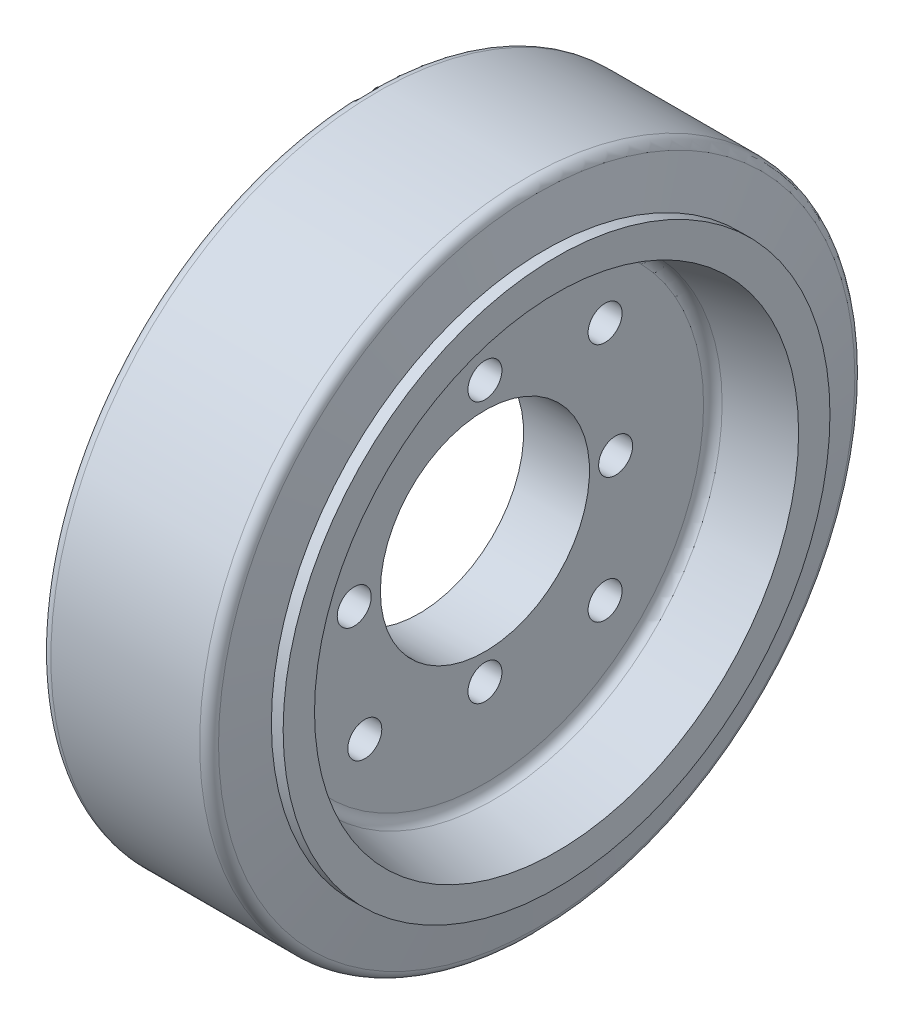
from build123d import *

# Parameters (mm, degrees)
FILLET1_R                  = 2
CUT_EXTRUDE1_DEPTH         = 93.869533426
CUT_EXTRUDE1_DEPTH_BACK    = 93.869533426
SKETCH2_R                  = 20
SKETCH3_R                  = 3.25
CUT_EXTRUDE2_DEPTH         = 93.218166533
F_6_5_6_5_DIAMETER_HOLE1_D = 6.5


with BuildPart() as part:
    # Sketch1 → Revolve1 (revolve)
    with BuildSketch(Plane.XY, mode=Mode.PRIVATE) as revolve1_sk:
        Polygon((-15.9, -62.5), (15.9, -62.5), (17.75, -52.3), (20, -52.3), (20, -46.3), (6.3, -43.45), (6.3, -17), (22.2, -15.75), (22.2, -10.05), (-22.2, -10.05), (-22.2, -15.75), (-6.3, -17), (-6.3, -43.45), (-20, -46.3), (-20, -52.3), (-17.75, -52.3), align=None)
    revolve(revolve1_sk.sketch.rotate(Axis((0, 0, 0), (1, 0, 0)), 270), axis=Axis((0, 0, 0), (1, 0, 0)))

    # Fillet1
    fillet1_edges = [part.edges().sort_by_distance(p)[0] for p in [
        (15.9, 0, -62.5),
        (-15.9, 0, -62.5),
        (-6.3, 0, -43.45),
        (-6.3, 0, -17),
        (-22.2, 0, -15.75),
        (22.2, 0, -15.75),
        (6.3, 0, -17),
        (6.3, 0, -43.45),
    ]]
    fillet(fillet1_edges, radius=FILLET1_R)

    # Sketch2 → Cut-Extrude1 (cut, two sides: drawn at the far end of the back side and taken through both)
    with BuildSketch(Plane.ZY.offset(6.3).offset(-CUT_EXTRUDE1_DEPTH_BACK)):
        Circle(SKETCH2_R)
    extrude(amount=CUT_EXTRUDE1_DEPTH + CUT_EXTRUDE1_DEPTH_BACK, mode=Mode.SUBTRACT)

    # Sketch3 → Cut-Extrude2 (cut, through all)
    with BuildSketch(Plane.ZY.offset(6.3)):
        with Locations((0, 25)):
            Circle(SKETCH3_R)
        with Locations((-25, 0)):
            Circle(SKETCH3_R)
        with Locations((0, -25)):
            Circle(SKETCH3_R)
        with Locations((25, 0)):
            Circle(SKETCH3_R)
    extrude(amount=-CUT_EXTRUDE2_DEPTH, mode=Mode.SUBTRACT)

    # Ø6.5 (6.5) Diameter Hole1 (through all)
    with Locations(Plane.ZY.offset(6.3)):
        with Locations((-22.980970389, 22.980970389), (-22.980970389, -22.980970389), (22.980970389, -22.980970389), (22.980970389, 22.980970389)):
            Hole(F_6_5_6_5_DIAMETER_HOLE1_D / 2)


solid = part.part
